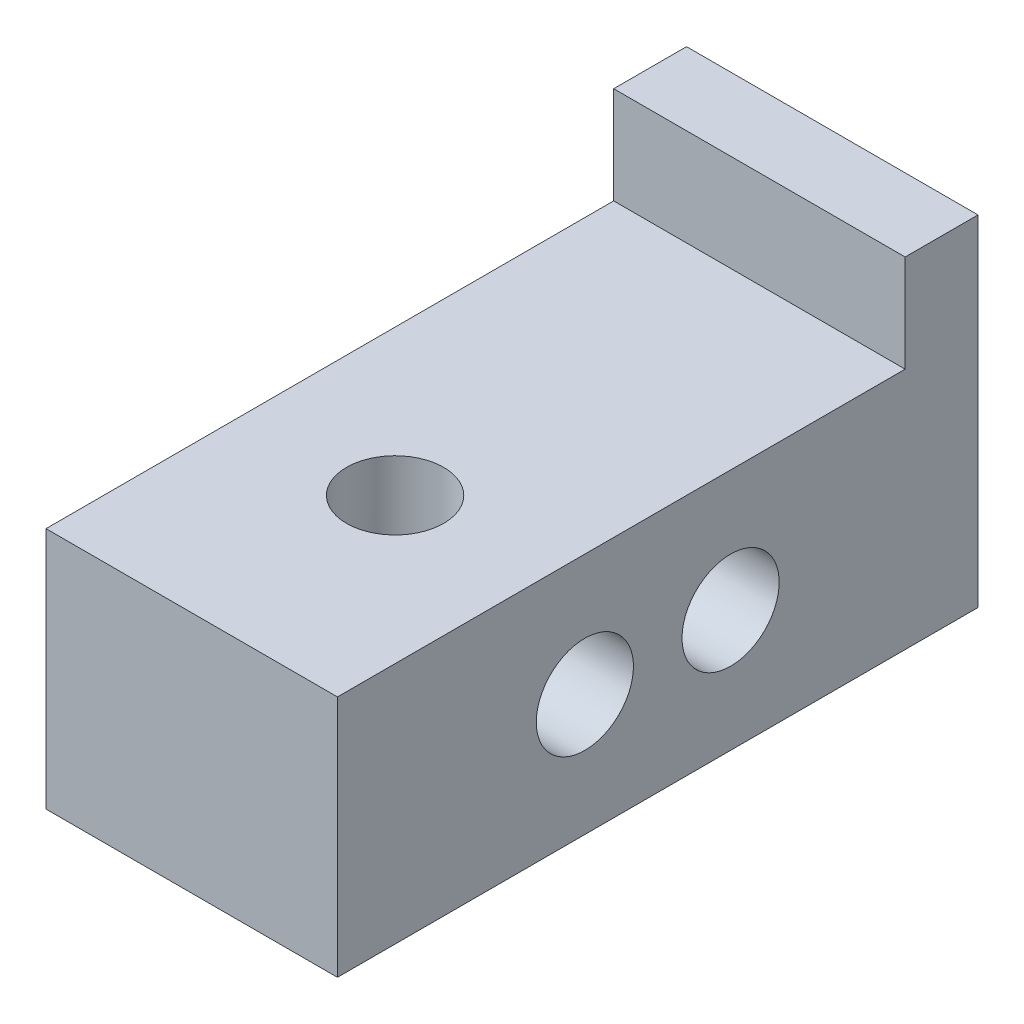
from build123d import *

# Parameters (mm, degrees)
SKETCH1_W                = 12
SKETCH1_H                = 23.373361116
SKETCH1_R                = 2
BOSS_EXTRUDE1_DEPTH      = 10
BOSS_EXTRUDE2_DEPTH      = 4
BOSS_EXTRUDE2_DEPTH_BACK = 10
SKETCH2_W                = 12
SKETCH2_H                = 3
SKETCH3_R                = 2
CUT_EXTRUDE1_DEPTH       = 14


with BuildPart() as part:
    # Sketch1 → Boss-Extrude1 (new body)
    with BuildSketch(Plane(origin=(0, 0, 0), x_dir=(1, 0, 0), z_dir=(0, 1, 0))):
        with Locations((0, 3.313319442)):
            Rectangle(SKETCH1_W, SKETCH1_H)
        with Locations(Location((0, 0, 0), (0, 0, 270))):
            Circle(SKETCH1_R, mode=Mode.SUBTRACT)
    extrude(amount=BOSS_EXTRUDE1_DEPTH)

    # Sketch2 → Boss-Extrude2 (add, two sides: drawn at the far end of the back side and taken through both)
    with BuildSketch(Plane(origin=(0, 10, 0), x_dir=(1, 0, 0), z_dir=(0, 1, 0)).offset(-BOSS_EXTRUDE2_DEPTH_BACK)):
        with Locations((0, 16.5)):
            Rectangle(SKETCH2_W, SKETCH2_H)
    extrude(amount=BOSS_EXTRUDE2_DEPTH + BOSS_EXTRUDE2_DEPTH_BACK)

    # Sketch3 → Cut-Extrude1 (cut)
    with BuildSketch(Plane.ZY.offset(6)):
        with Locations((-7.813319442, 5)):
            Circle(SKETCH3_R)
        with Locations((-1.813319442, 5)):
            Circle(SKETCH3_R)
    extrude(amount=-CUT_EXTRUDE1_DEPTH, mode=Mode.SUBTRACT)


solid = part.part
